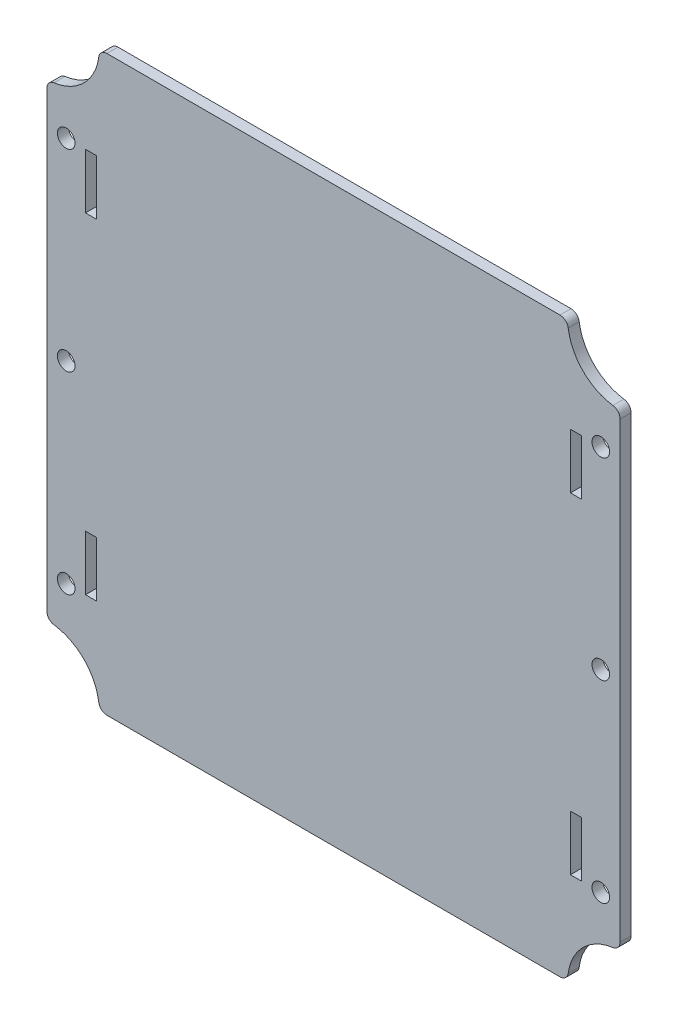
from build123d import *

# Parameters (mm, degrees)
CROQUIS1_R              = 1.6
CROQUIS1_W              = 2
CROQUIS1_H              = 10
SALIENTE_EXTRUIR1_DEPTH = 2


with BuildPart() as part:
    # Croquis1 → Saliente-Extruir1 (new body)
    with BuildSketch(Plane.XY):
        with BuildLine():
            Line((10.897247359, 0), (93.102752641, 0))
            ThreePointArc((93.102752641, 0), (94.088445752, 0.369332458), (94.588740917, 1.295454545))
            ThreePointArc((94.588740917, 1.295454545), (97.282485579, 6.717514421), (102.704545455, 9.411259083))
            ThreePointArc((102.704545455, 9.411259083), (103.630667542, 9.911554248), (104, 10.897247359))
            Line((104, 10.897247359), (104, 93.102752641))
            ThreePointArc((104, 93.102752641), (103.630667542, 94.088445752), (102.704545455, 94.588740917))
            ThreePointArc((102.704545455, 94.588740917), (97.282485579, 97.282485579), (94.588740917, 102.704545455))
            ThreePointArc((94.588740917, 102.704545455), (94.088445752, 103.630667542), (93.102752641, 104))
            Line((93.102752641, 104), (10.897247359, 104))
            ThreePointArc((10.897247359, 104), (9.911554248, 103.630667542), (9.411259083, 102.704545455))
            ThreePointArc((9.411259083, 102.704545455), (6.717514421, 97.282485579), (1.295454545, 94.588740917))
            ThreePointArc((1.295454545, 94.588740917), (0.369332458, 94.088445752), (0, 93.102752641))
            Line((0, 93.102752641), (0, 10.897247359))
            ThreePointArc((0, 10.897247359), (0.369332458, 9.911554248), (1.295454545, 9.411259083))
            ThreePointArc((1.295454545, 9.411259083), (6.717514421, 6.717514421), (9.411259083, 1.295454545))
            ThreePointArc((9.411259083, 1.295454545), (9.911554248, 0.369332458), (10.897247359, 0))
        make_face()
        with Locations((3.5, 52)):
            Circle(CROQUIS1_R, mode=Mode.SUBTRACT)
        with Locations((3.5, 87)):
            Circle(CROQUIS1_R, mode=Mode.SUBTRACT)
        with Locations(Location((3.5, 17, 0), (0, 0, 180))):
            Circle(CROQUIS1_R, mode=Mode.SUBTRACT)
        with Locations((100.5, 17)):
            Circle(CROQUIS1_R, mode=Mode.SUBTRACT)
        with Locations(Location((100.5, 52, 0), (0, 0, 180))):
            Circle(CROQUIS1_R, mode=Mode.SUBTRACT)
        with Locations(Location((100.5, 87, 0), (0, 0, 180))):
            Circle(CROQUIS1_R, mode=Mode.SUBTRACT)
        with Locations((8, 82)):
            Rectangle(CROQUIS1_W, CROQUIS1_H, mode=Mode.SUBTRACT)
        with Locations((96, 82)):
            Rectangle(CROQUIS1_W, CROQUIS1_H, mode=Mode.SUBTRACT)
        with Locations((96, 22)):
            Rectangle(CROQUIS1_W, CROQUIS1_H, mode=Mode.SUBTRACT)
        with Locations((8, 22)):
            Rectangle(CROQUIS1_W, CROQUIS1_H, mode=Mode.SUBTRACT)
    extrude(amount=-SALIENTE_EXTRUIR1_DEPTH)


solid = part.part
